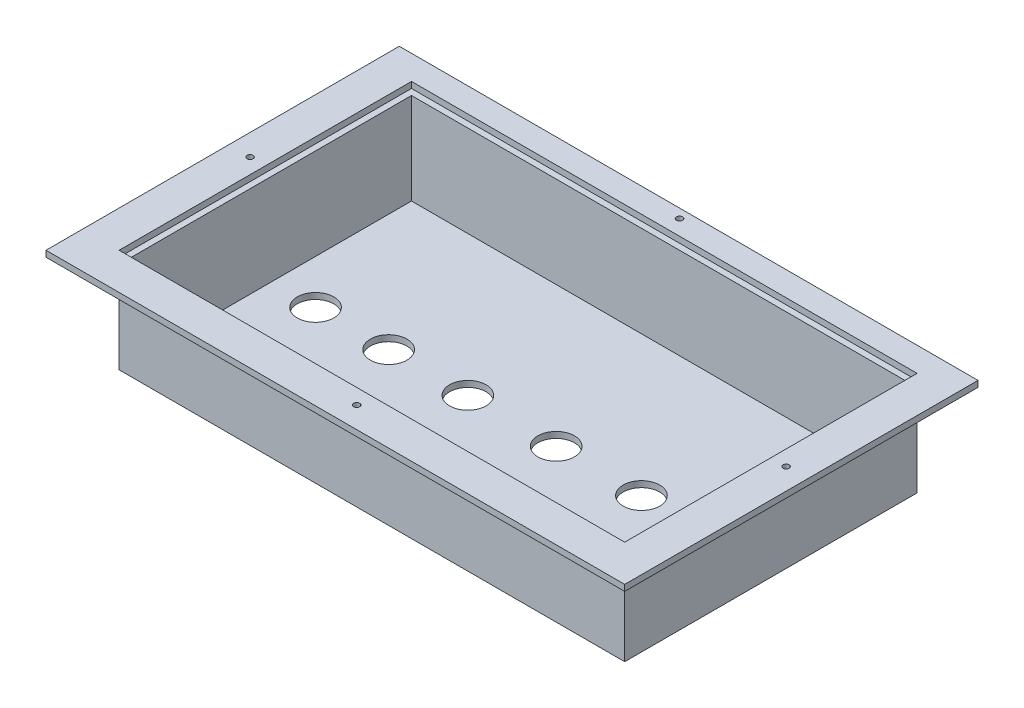
from build123d import *

# Parameters (mm, degrees)
SKETCH2_W           = 166
SKETCH2_H           = 96
SKETCH2_R           = 6
SKETCH2_R_2         = 4.5
SKETCH2_R_3         = 5.563835096
BOSS_EXTRUDE1_DEPTH = 2
SKETCH3_W           = 166
SKETCH3_H           = 96
SKETCH3_W_2         = 162
SKETCH3_H_2         = 92
BOSS_EXTRUDE2_DEPTH = 30
SKETCH4_W           = 190
SKETCH4_H           = 112
SKETCH4_R           = 1
SKETCH4_W_2         = 166
SKETCH4_H_2         = 96
SKETCH4_H_3         = 4
BOSS_EXTRUDE3_DEPTH = 2


with BuildPart() as part:
    # Sketch2 → Boss-Extrude1 (new body)
    with BuildSketch(Plane(origin=(0, 0, 0), x_dir=(1, 0, 0), z_dir=(0, 1, 0))):
        Rectangle(SKETCH2_W, SKETCH2_H)
        with Locations(Location((-66.5, 0, 0), (0, 0, 270))):
            Circle(SKETCH2_R, mode=Mode.SUBTRACT)
        with Locations(Location((-42.5, 0, 0), (0, 0, 270))):
            Circle(SKETCH2_R, mode=Mode.SUBTRACT)
        with Locations(Location((-16.5, 0, 0), (0, 0, 270))):
            Circle(SKETCH2_R, mode=Mode.SUBTRACT)
        with Locations(Location((12.5, 0, 0), (0, 0, 270))):
            Circle(SKETCH2_R, mode=Mode.SUBTRACT)
        with Locations(Location((40.5, 0, 0), (0, 0, 270))):
            Circle(SKETCH2_R, mode=Mode.SUBTRACT)
        with Locations(Location((67.004282655, 4.709850107, 0), (0, 0, 270))):
            Circle(SKETCH2_R_2, mode=Mode.SUBTRACT)
        with Locations(Location((67.004282655, -8.442184154, 0), (0, 0, 270))):
            Circle(SKETCH2_R_2, mode=Mode.SUBTRACT)
        with Locations(Location((67.004282655, 22.969944987, 0), (0, 0, 270))):
            Circle(SKETCH2_R_3, mode=Mode.SUBTRACT)
    extrude(amount=BOSS_EXTRUDE1_DEPTH)

    # Sketch3 → Boss-Extrude2 (add)
    with BuildSketch(Plane(origin=(0, 2, 0), x_dir=(1, 0, 0), z_dir=(0, 1, 0))):
        Rectangle(SKETCH3_W, SKETCH3_H)
        Rectangle(SKETCH3_W_2, SKETCH3_H_2, mode=Mode.SUBTRACT)
    extrude(amount=BOSS_EXTRUDE2_DEPTH)


with BuildPart() as body_2:
    # Sketch4 → Boss-Extrude3 (new body)
    # profile 1 of 2: a face of its own
    with BuildSketch(Plane(origin=(0, 32, 0), x_dir=(1, 0, 0), z_dir=(0, 1, 0))):
        Rectangle(SKETCH4_W, SKETCH4_H)
        with Locations(Location((88, 0, 0), (0, 0, 270))):
            Circle(SKETCH4_R, mode=Mode.SUBTRACT)
        with Locations(Location((0, 53, 0), (0, 0, 270))):
            Circle(SKETCH4_R, mode=Mode.SUBTRACT)
        with Locations(Location((-88, 0, 0), (0, 0, 270))):
            Circle(SKETCH4_R, mode=Mode.SUBTRACT)
        with Locations(Location((0, -53, 0), (0, 0, 270))):
            Circle(SKETCH4_R, mode=Mode.SUBTRACT)
        Rectangle(SKETCH4_W_2, SKETCH4_H_2, mode=Mode.SUBTRACT)
    # profile 2 of 2: a face of its own
    with BuildSketch(Plane(origin=(0, 32, 0), x_dir=(1, 0, 0), z_dir=(0, 1, 0))):
        with Locations((0, -58)):
            Rectangle(SKETCH4_W, SKETCH4_H_3)
    extrude(amount=BOSS_EXTRUDE3_DEPTH)


solid = Compound([part.part, body_2.part])
